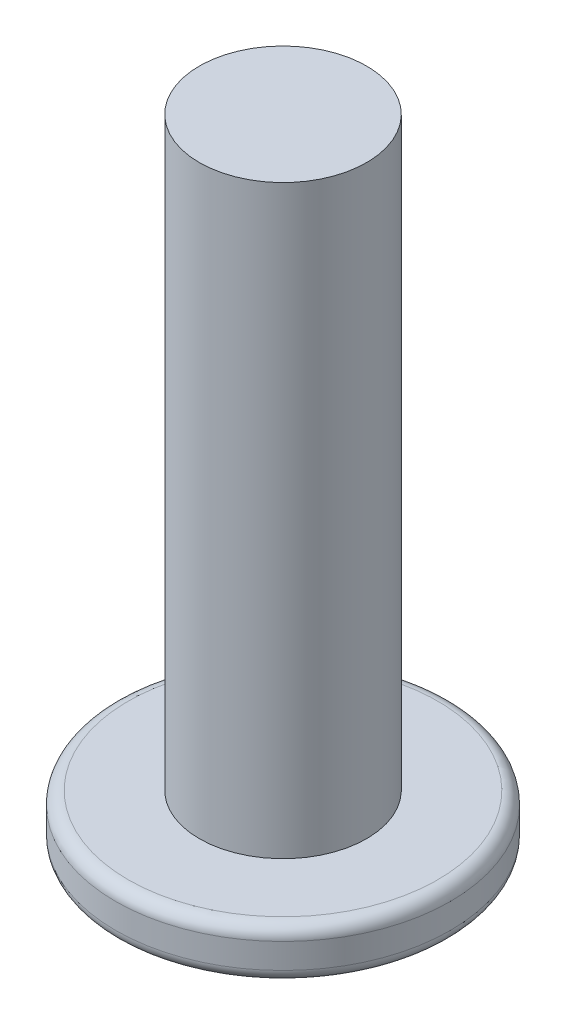
from build123d import *

# Parameters (mm, degrees)
SKETCH1_R           = 4
BOSS_EXTRUDE1_DEPTH = 1.2
SKETCH2_R           = 2
BOSS_EXTRUDE2_DEPTH = 14
FILLET2_R           = 0.3
CUT_EXTRUDE1_DEPTH  = 0.6


with BuildPart() as part:
    # Sketch1 → Boss-Extrude1 (new body)
    with BuildSketch(Plane(origin=(0, 0, 0), x_dir=(1, 0, 0), z_dir=(0, 1, 0))):
        with Locations(Location((0, 0, 0), (0, 0, 270))):
            Circle(SKETCH1_R)
    extrude(amount=BOSS_EXTRUDE1_DEPTH)

    # Sketch2 → Boss-Extrude2 (add)
    with BuildSketch(Plane(origin=(0, 1.2, 0), x_dir=(1, 0, 0), z_dir=(0, 1, 0))):
        with Locations(Location((0, 0, 0), (0, 0, 270))):
            Circle(SKETCH2_R)
    extrude(amount=BOSS_EXTRUDE2_DEPTH)

    # Fillet2
    fillet2_edges = [part.edges().sort_by_distance(p)[0] for p in [
        (0, 0, -4),
        (0, 1.2, -4),
    ]]
    fillet(fillet2_edges, radius=FILLET2_R)

    # Sketch3 → Cut-Extrude1 (cut)
    with BuildSketch(Plane.XZ):
        Polygon((1.443375673, 0), (0.721687836, 1.25), (-0.721687836, 1.25), (-1.443375673, 0), (-0.721687836, -1.25), (0.721687836, -1.25), align=None)
    extrude(amount=-CUT_EXTRUDE1_DEPTH, mode=Mode.SUBTRACT)


solid = part.part
